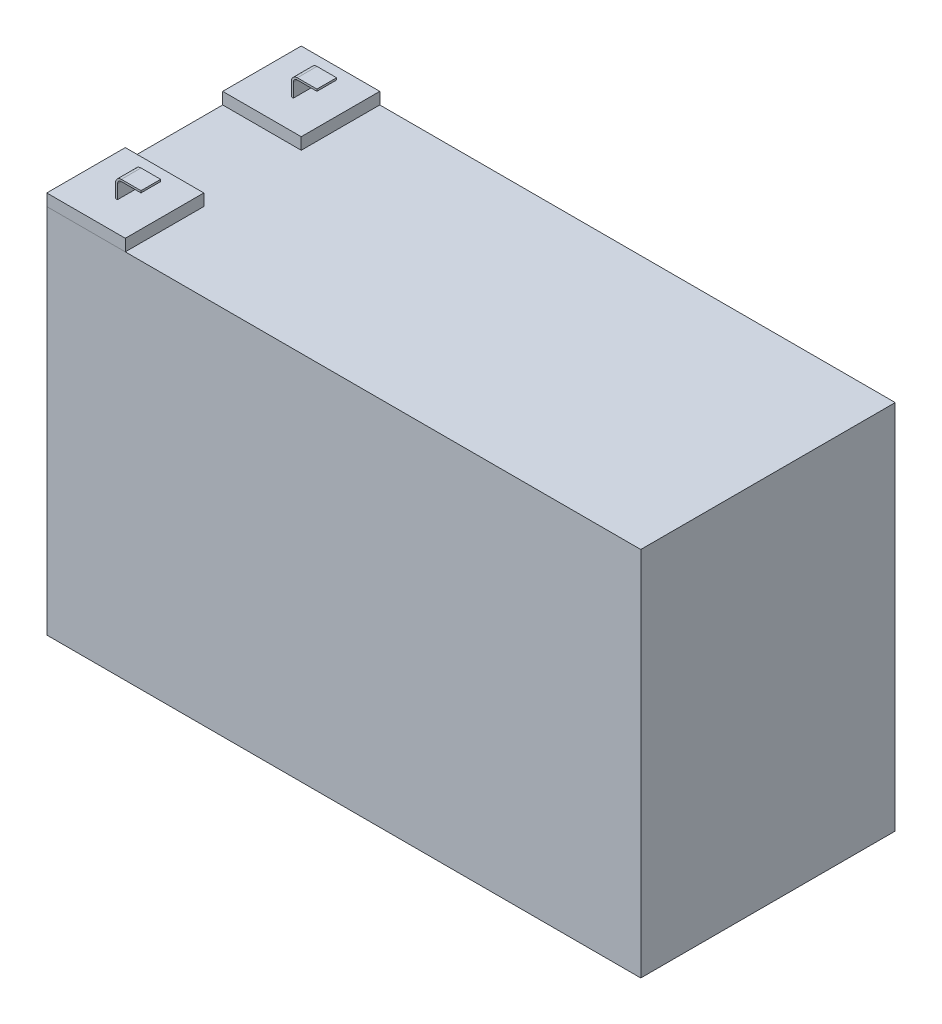
from build123d import *

# Parameters (mm, degrees)
SKETCH1_W                = 151.26
SKETCH1_H                = 64.8
BOSS_EXTRUDE1_DEPTH      = 94.5
SKETCH2_W                = 20
SKETCH2_H                = 20
BOSS_EXTRUDE2_DEPTH      = 3
BOSS_EXTRUDE3_DEPTH      = 2.5
BOSS_EXTRUDE3_DEPTH_BACK = 2.5


with BuildPart() as part:
    # Sketch1 → Boss-Extrude1 (new body)
    with BuildSketch(Plane(origin=(0, 0, 0), x_dir=(1, 0, 0), z_dir=(0, 1, 0))):
        Rectangle(SKETCH1_W, SKETCH1_H)
    extrude(amount=BOSS_EXTRUDE1_DEPTH)


with BuildPart() as body_2:
    # Sketch2 → Boss-Extrude2 (new body)
    with BuildSketch(Plane(origin=(0, 94.5, 0), x_dir=(1, 0, 0), z_dir=(0, 1, 0))):
        with Locations((-65.63, -22.4)):
            Rectangle(SKETCH2_W, SKETCH2_H)
    extrude(amount=BOSS_EXTRUDE2_DEPTH)


with BuildPart() as body_3:
    # Sketch3 → Boss-Extrude3 (new, two sides: drawn at the far end of the back side and taken through both)
    with BuildSketch(Plane.XY.offset(22.4).offset(-BOSS_EXTRUDE3_DEPTH_BACK)):
        with BuildLine():
            Line((-65.63, 97.5), (-65.63, 101))
            ThreePointArc((-65.63, 101), (-65.190660172, 102.060660172), (-64.13, 102.5))
            Line((-64.13, 102.5), (-59.13, 102.5))
            Line((-59.13, 102.5), (-59.13, 102))
            Line((-59.13, 102), (-64.13, 102))
            ThreePointArc((-64.13, 102), (-64.837106781, 101.707106781), (-65.13, 101))
            Line((-65.13, 101), (-65.13, 97.5))
            Line((-65.13, 97.5), (-65.63, 97.5))
        make_face()
    extrude(amount=BOSS_EXTRUDE3_DEPTH + BOSS_EXTRUDE3_DEPTH_BACK)


with BuildPart() as body_4:
    # Mirror1: mirrored copy
    add(body_3.part.mirror(Plane.XY))


with BuildPart() as body_5:
    # Mirror1 2: mirrored copy
    add(body_2.part.mirror(Plane.XY))


solid = Compound([part.part, body_2.part, body_3.part, body_4.part, body_5.part])
